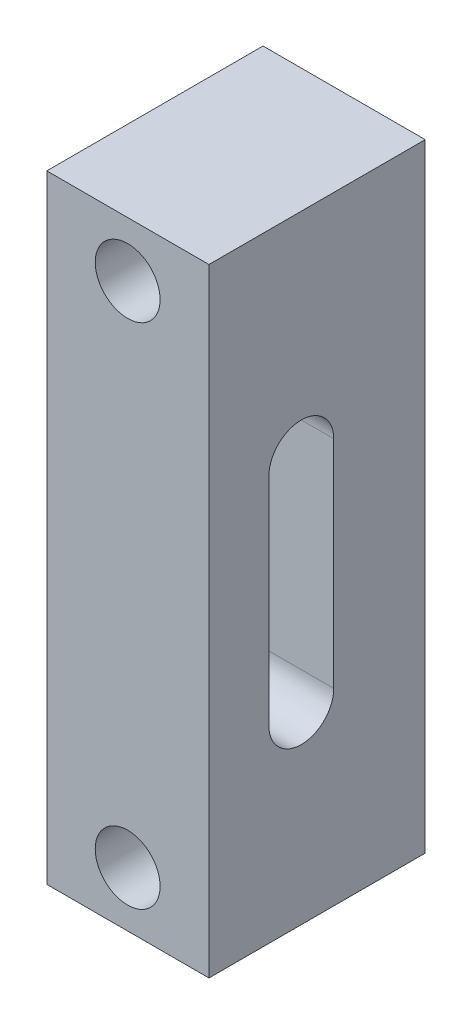
from build123d import *

# Parameters (mm, degrees)
SKETCH1_W                    = 15
SKETCH1_H                    = 57.15
BOSS_EXTRUDE1_DEPTH          = 20
F_6_0_6_DIAMETER_HOLE1_D     = 6
F_6_0_6_DIAMETER_HOLE1_DEPTH = 24
F_6_0_6_DIAMETER_HOLE1_TIP   = 1.802581857
CUT_EXTRUDE1_DEPTH           = 211.546449087


with BuildPart() as part:
    # Sketch1 → Boss-Extrude1 (new body)
    with BuildSketch(Plane.XY):
        with Locations((34.966141976, -180.481947321)):
            Rectangle(SKETCH1_W, SKETCH1_H)
    extrude(amount=BOSS_EXTRUDE1_DEPTH)

    # Ø6.0 (6) Diameter Hole1
    with Locations(Plane(origin=(0, 0, 0), x_dir=(-1, 0, 0), z_dir=(0, 0, -1))):
        with Locations((-34.946141976, -156.986877707), (-34.946141976, -203.976877703)):
            Hole(F_6_0_6_DIAMETER_HOLE1_D / 2, depth=F_6_0_6_DIAMETER_HOLE1_DEPTH)
            with Locations((0, 0, -(F_6_0_6_DIAMETER_HOLE1_DEPTH + F_6_0_6_DIAMETER_HOLE1_TIP / 2))):  # 118° drill point
                Cone(0, F_6_0_6_DIAMETER_HOLE1_D / 2, F_6_0_6_DIAMETER_HOLE1_TIP, mode=Mode.SUBTRACT)

    # Sketch5 → Cut-Extrude1 (cut, through all)
    with BuildSketch(Plane(origin=(42.466141976, 0, 0), x_dir=(0, 0, -1), z_dir=(1, 0, 0))):
        with BuildLine():
            Line((-14.46, -171.629796136), (-14.46, -191.629796136))
            ThreePointArc((-14.46, -191.629796136), (-11.46, -194.629796136), (-8.46, -191.629796136))
            Line((-8.46, -191.629796136), (-8.46, -171.629796136))
            ThreePointArc((-8.46, -171.629796136), (-11.46, -168.629796136), (-14.46, -171.629796136))
        make_face()
    extrude(amount=-CUT_EXTRUDE1_DEPTH, mode=Mode.SUBTRACT)


solid = part.part
